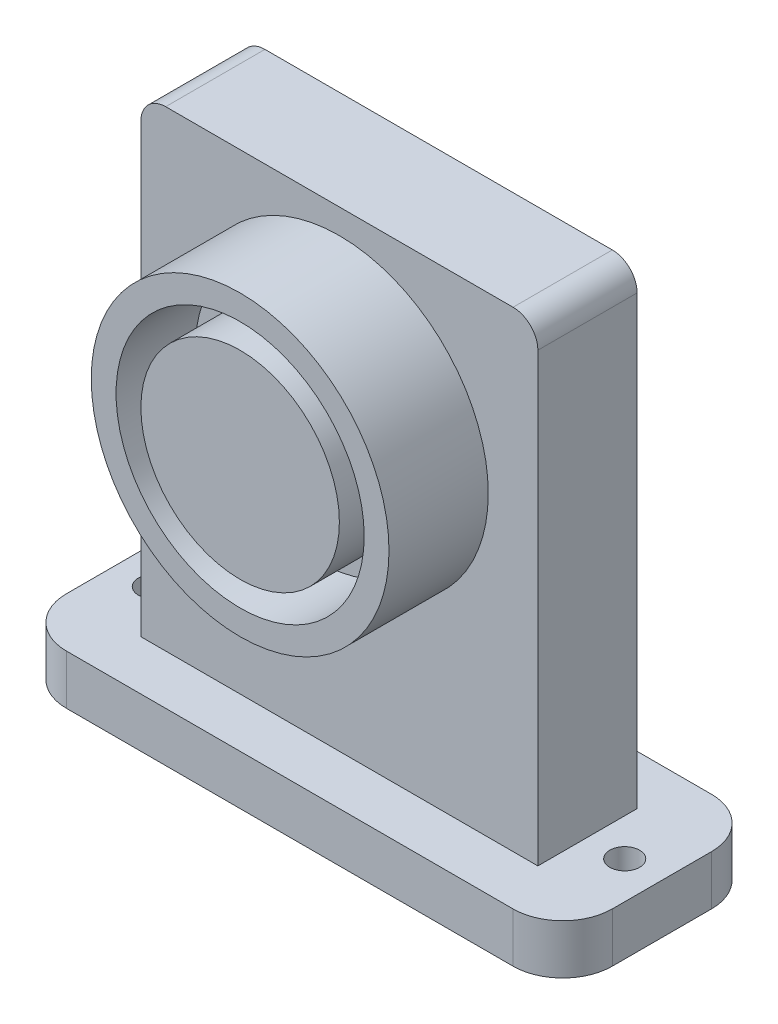
from build123d import *

# Parameters (mm, degrees)
SKETCH1_W           = 40
SKETCH1_H           = 70
BOSS_EXTRUDE1_DEPTH = 10
SKETCH4_R           = 15
BOSS_EXTRUDE3_DEPTH = 10
SKETCH5_R           = 12.5
SKETCH5_R_2         = 10
CUT_EXTRUDE2_DEPTH  = 8
SKETCH6_W           = 40
SKETCH6_H           = 10
CUT_EXTRUDE3_DEPTH  = 17.5
FILLET4_R           = 2.5
SKETCH11_R          = 1.5
SKETCH11_W          = 40
SKETCH11_H          = 10
BOSS_EXTRUDE4_DEPTH = 5


with BuildPart() as part:
    # Sketch1 → Boss-Extrude1 (new body)
    with BuildSketch(Plane.XY):
        Rectangle(SKETCH1_W, SKETCH1_H)
    extrude(amount=BOSS_EXTRUDE1_DEPTH)

    # Sketch4 → Boss-Extrude3 (add)
    with BuildSketch(Plane.XY.offset(10)):
        Circle(SKETCH4_R)
    extrude(amount=BOSS_EXTRUDE3_DEPTH)

    # Sketch5 → Cut-Extrude2 (cut)
    with BuildSketch(Plane.XY.offset(20)):
        Circle(SKETCH5_R)
        Circle(SKETCH5_R_2, mode=Mode.SUBTRACT)
    extrude(amount=-CUT_EXTRUDE2_DEPTH, mode=Mode.SUBTRACT)

    # Sketch6 → Cut-Extrude3 (cut)
    with BuildSketch(Plane(origin=(0, 35, 0), x_dir=(1, 0, 0), z_dir=(0, 1, 0))):
        with Locations((0, -5)):
            Rectangle(SKETCH6_W, SKETCH6_H)
    extrude(amount=-CUT_EXTRUDE3_DEPTH, mode=Mode.SUBTRACT)

    # Fillet4
    fillet4_edges = [part.edges().sort_by_distance(p)[0] for p in [
        (-20, 17.5, 5),
        (20, 17.5, 5),
    ]]
    fillet(fillet4_edges, radius=FILLET4_R)

    # Sketch11 → Boss-Extrude4 (add)
    with BuildSketch(Plane.XZ.offset(35)):
        with BuildLine():
            Line((-22.5, 15), (22.5, 15))
            ThreePointArc((22.5, 15), (26.035533906, 13.535533906), (27.5, 10))
            Line((27.5, 10), (27.5, 0))
            ThreePointArc((27.5, 0), (26.035533906, -3.535533906), (22.5, -5))
            Line((22.5, -5), (-22.5, -5))
            ThreePointArc((-22.5, -5), (-26.035533906, -3.535533906), (-27.5, 0))
            Line((-27.5, 0), (-27.5, 10))
            ThreePointArc((-27.5, 10), (-26.035533906, 13.535533906), (-22.5, 15))
        make_face()
        with Locations((-23.75, 5)):
            Circle(SKETCH11_R, mode=Mode.SUBTRACT)
        with Locations(Location((23.75, 5, 0), (0, 0, 180))):
            Circle(SKETCH11_R, mode=Mode.SUBTRACT)
        with Locations((0, 5)):
            Rectangle(SKETCH11_W, SKETCH11_H, mode=Mode.SUBTRACT)
    extrude(amount=-BOSS_EXTRUDE4_DEPTH)


solid = part.part
